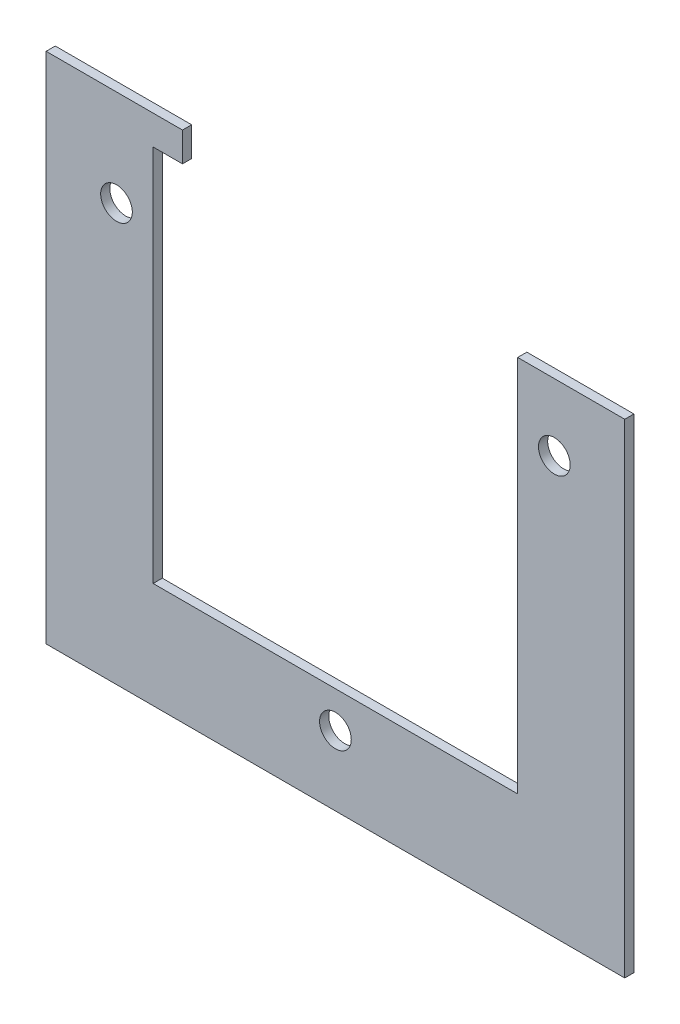
from build123d import *

# Parameters (mm, degrees)
SKETCH1_R           = 1.3716
BOSS_EXTRUDE1_DEPTH = 0.79375


with BuildPart() as part:
    # Sketch1 → Boss-Extrude1 (new body)
    with BuildSketch(Plane.XY):
        Polygon((7520.082561002, 3427.612295977), (7529.353561002, 3427.612295977), (7529.353561002, 3385.702295977), (7479.239361002, 3385.702295977), (7479.239361002, 3430.152295977), (7491.050361002, 3430.152295977), (7491.050361002, 3427.612295977), (7488.510361002, 3427.612295977), (7488.510361002, 3394.871695977), (7520.082561002, 3394.871695977), align=None)
        with Locations((7504.296461002, 3391.734923559)):
            Circle(SKETCH1_R, mode=Mode.SUBTRACT)
        with Locations((7523.257561002, 3421.821095977)):
            Circle(SKETCH1_R, mode=Mode.SUBTRACT)
        with Locations((7485.335361002, 3421.821095977)):
            Circle(SKETCH1_R, mode=Mode.SUBTRACT)
    extrude(amount=BOSS_EXTRUDE1_DEPTH)


solid = part.part
